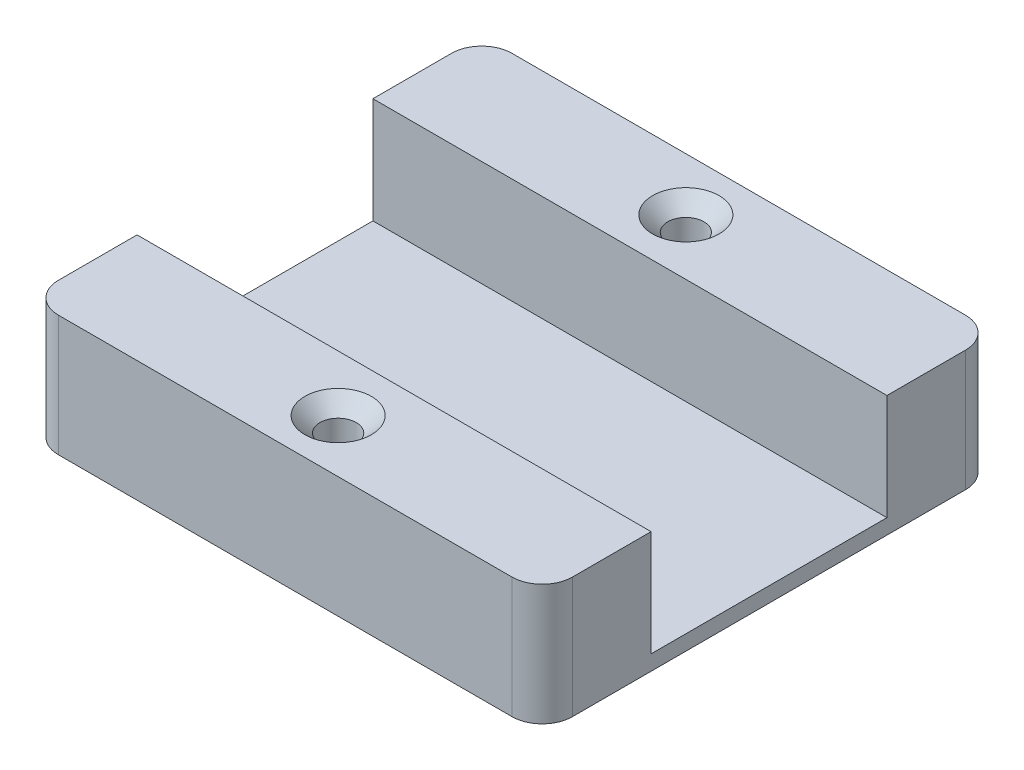
from build123d import *

# Parameters (mm, degrees)
BOSS_EXTRUDE1_DEPTH = 8
SKETCH2_W           = 7.8
SKETCH2_H           = 7
CUT_EXTRUDE1_DEPTH  = 25.04163056
CHAMFER1_SIZE       = 1
FILLET1_R           = 2


with BuildPart() as part:
    # Sketch1 → Boss-Extrude1 (new body)
    with BuildSketch(Plane(origin=(0, 0, 0), x_dir=(1, 0, 0), z_dir=(0, 1, 0))):
        with BuildLine():
            Line((17, 4.7), (17, 15))
            Line((17, 15), (0, 15))
            Line((0, 15), (0, 0))
            Line((0, 0), (17, 0))
            Line((17, 0), (17, 2.3))
            ThreePointArc((17, 2.3), (15.8, 3.5), (17, 4.7))
        make_face()
    extrude(amount=BOSS_EXTRUDE1_DEPTH)

    # Sketch2 → Cut-Extrude1 (cut, through all)
    with BuildSketch(Plane(origin=(17, 0, 0), x_dir=(0, 0, -1), z_dir=(1, 0, 0))):
        with Locations((11.1, 4.5)):
            Rectangle(SKETCH2_W, SKETCH2_H)
    extrude(amount=-CUT_EXTRUDE1_DEPTH, mode=Mode.SUBTRACT)

    # Chamfer1
    chamfer1_edges = [part.edges().sort_by_distance(p)[0] for p in [
        (15.8, 8, -3.5),
    ]]
    chamfer(chamfer1_edges, length=CHAMFER1_SIZE)

    # Mirror1: part across plane


with BuildPart() as part_1:
    add(part.part)
    add(part.part.mirror(Plane(origin=(17, 8, -4.7), x_dir=(0, 0, 1), z_dir=(-1, 0, 0))))

    # Mirror2: part across plane


with BuildPart() as part_2:
    add(part_1.part)
    add(part_1.part.mirror(Plane(origin=(0, 8, -15), x_dir=(1, 0, 0), z_dir=(0, 0, 1))))

    # Fillet1
    fillet1_edges = [part_2.edges().sort_by_distance(p)[0] for p in [
        (0, 4, 0),
        (34, 4, 0),
        (0, 4, -30),
        (34, 4, -30),
    ]]
    fillet(fillet1_edges, radius=FILLET1_R)


solid = part_2.part
